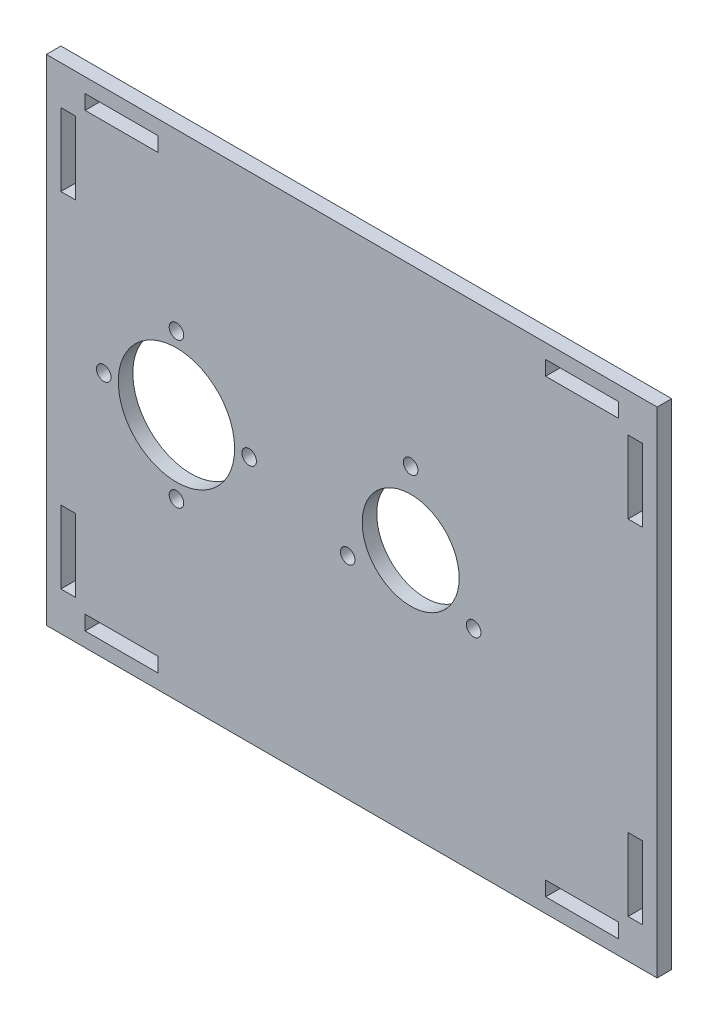
from build123d import *

# Parameters (mm, degrees)
SKETCH1_W           = 126
SKETCH1_H           = 102
SKETCH1_R           = 12
SKETCH1_R_2         = 10
SKETCH1_W_2         = 3
SKETCH1_H_2         = 15
SKETCH1_W_3         = 15
SKETCH1_H_3         = 3
BOSS_EXTRUDE1_DEPTH = 3
SKETCH2_R           = 1.5
CUT_EXTRUDE1_DEPTH  = 3
CIRPATTERN1_COUNT   = 3
SKETCH3_R           = 1.5
CUT_EXTRUDE2_DEPTH  = 3
CIRPATTERN2_COUNT   = 4


with BuildPart() as part:
    # Sketch1 → Boss-Extrude1 (new body)
    with BuildSketch(Plane.XY):
        with Locations((12, 0)):
            Rectangle(SKETCH1_W, SKETCH1_H)
        with Locations((-24.15725, 0)):
            Circle(SKETCH1_R, mode=Mode.SUBTRACT)
        with Locations((24.15725, 0)):
            Circle(SKETCH1_R_2, mode=Mode.SUBTRACT)
        with Locations((-46.5, -35.5)):
            Rectangle(SKETCH1_W_2, SKETCH1_H_2, mode=Mode.SUBTRACT)
        with Locations((-46.5, 35.5)):
            Rectangle(SKETCH1_W_2, SKETCH1_H_2, mode=Mode.SUBTRACT)
        with Locations((70.5, -35.5)):
            Rectangle(SKETCH1_W_2, SKETCH1_H_2, mode=Mode.SUBTRACT)
        with Locations((70.5, 35.5)):
            Rectangle(SKETCH1_W_2, SKETCH1_H_2, mode=Mode.SUBTRACT)
        with Locations((-35.5, 46.5)):
            Rectangle(SKETCH1_W_3, SKETCH1_H_3, mode=Mode.SUBTRACT)
        with Locations((59.5, 46.5)):
            Rectangle(SKETCH1_W_3, SKETCH1_H_3, mode=Mode.SUBTRACT)
        with Locations((-35.5, -46.5)):
            Rectangle(SKETCH1_W_3, SKETCH1_H_3, mode=Mode.SUBTRACT)
        with Locations((59.5, -46.5)):
            Rectangle(SKETCH1_W_3, SKETCH1_H_3, mode=Mode.SUBTRACT)
    extrude(amount=BOSS_EXTRUDE1_DEPTH)

    # Sketch2 → Cut-Extrude1 (cut)
    with BuildSketch(Plane.XY.offset(3)):
        with Locations((24.15725, 15)):
            Circle(SKETCH2_R)
    cut_extrude1 = extrude(amount=-CUT_EXTRUDE1_DEPTH, mode=Mode.SUBTRACT)

    # CirPattern1: Cut-Extrude1 ×3 about axis
    cirpattern1_axis = Axis((24.15725, 0, 0), (0, 0, 1))
    for i in range(1, CIRPATTERN1_COUNT):
        add(cut_extrude1.rotate(cirpattern1_axis, i * 360 / CIRPATTERN1_COUNT), mode=Mode.SUBTRACT)

    # Sketch3 → Cut-Extrude2 (cut)
    with BuildSketch(Plane.XY.offset(3)):
        with Locations((-24.15725, 15)):
            Circle(SKETCH3_R)
    cut_extrude2 = extrude(amount=-CUT_EXTRUDE2_DEPTH, mode=Mode.SUBTRACT)

    # CirPattern2: Cut-Extrude2 ×4 about axis
    cirpattern2_axis = Axis((-24.15725, 0, 0), (0, 0, 1))
    for i in range(1, CIRPATTERN2_COUNT):
        add(cut_extrude2.rotate(cirpattern2_axis, i * 360 / CIRPATTERN2_COUNT), mode=Mode.SUBTRACT)


solid = part.part
